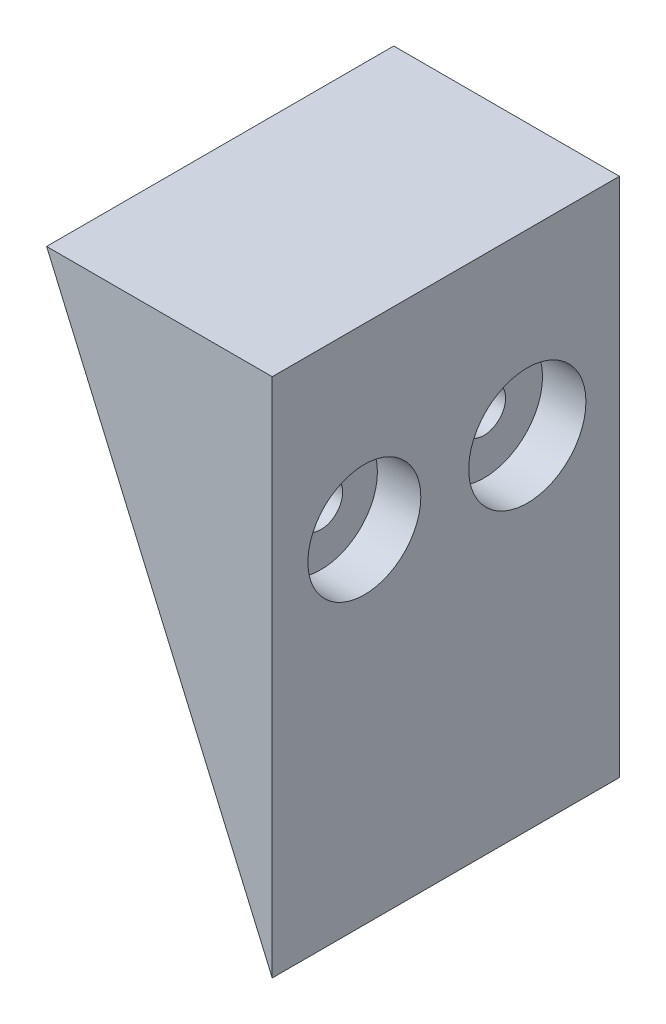
from build123d import *

# Parameters (mm, degrees)
BOSS_EXTRU_1_DEPTH      = 40
ESQUISSE4_R             = 2.5
ENL_V_MAT_EXTRU_2_DEPTH = 80
ESQUISSE6_R             = 6.505119939
ESQUISSE6_R_2           = 6.755806102
ENL_V_MAT_EXTRU_3_DEPTH = 5


with BuildPart() as part:
    # Esquisse2 → Boss.-Extru.1 (new body)
    with BuildSketch(Plane.XY):
        Polygon((0, 0), (0, 60), (-26, 60), align=None)
    extrude(amount=BOSS_EXTRU_1_DEPTH)

    # Esquisse4 → Enlèv. mat.-Extru.2 (cut)
    with BuildSketch(Plane(origin=(0, 0, 0), x_dir=(0, 0, -1), z_dir=(1, 0, 0))):
        with Locations((-29.388047062, 39.440308957)):
            Circle(ESQUISSE4_R)
        with Locations((-10.611952938, 39.440308957)):
            Circle(ESQUISSE4_R)
    extrude(amount=-ENL_V_MAT_EXTRU_2_DEPTH, mode=Mode.SUBTRACT)

    # Esquisse6 → Enlèv. mat.-Extru.3 (cut)
    with BuildSketch(Plane(origin=(0, 0, 0), x_dir=(0, 0, -1), z_dir=(1, 0, 0))):
        with Locations((-29.388047062, 39.440308957)):
            Circle(ESQUISSE6_R)
        with Locations((-10.611952938, 39.440308957)):
            Circle(ESQUISSE6_R_2)
    extrude(amount=-ENL_V_MAT_EXTRU_3_DEPTH, mode=Mode.SUBTRACT)


solid = part.part
